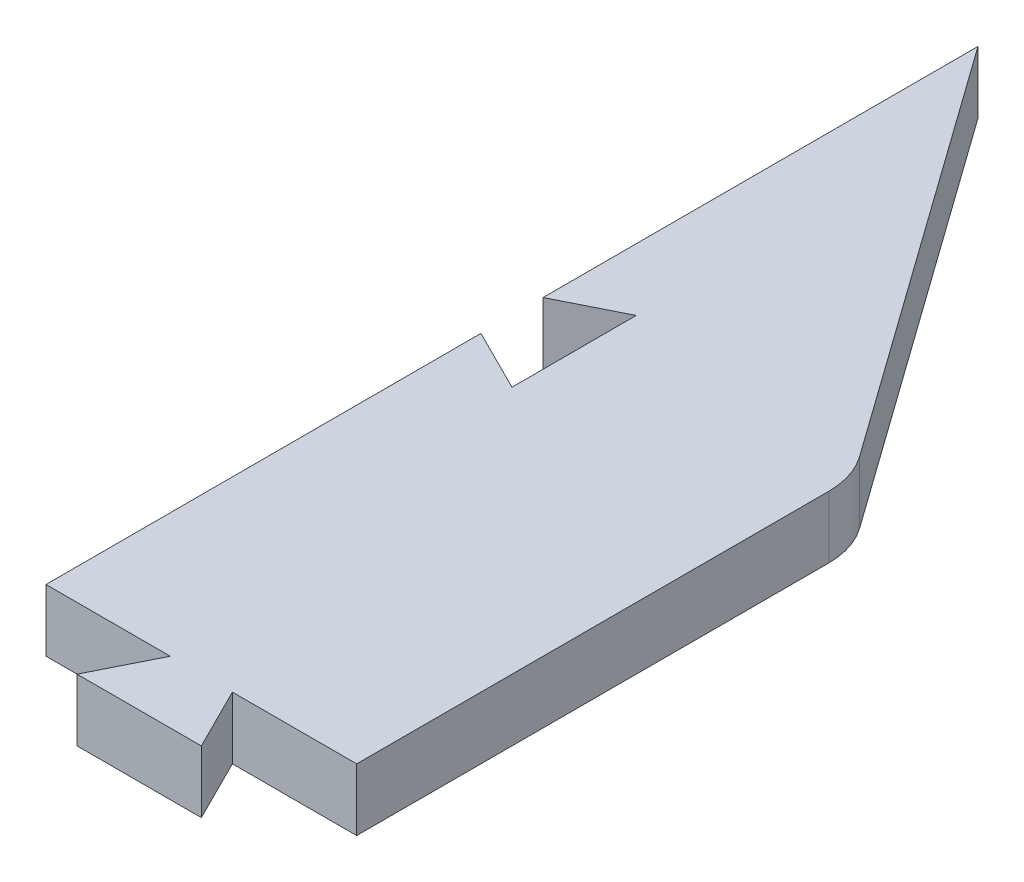
from build123d import *

# Parameters (mm, degrees)
EXTRUDE_1_DEPTH = 4


with BuildPart() as part:
    # Эскиз1 → Бобышка-Вытянуть1 (new body)
    with BuildSketch(Plane(origin=(0, 0, 0), x_dir=(1, 0, 0), z_dir=(0, 1, 0))):
        with BuildLine():
            Line((29.068667356, 15.803865702), (10, 42.5))
            Line((10, 42.5), (10, 14.5))
            Line((10, 14.5), (14, 16.5))
            Line((14, 16.5), (14, 8.5))
            Line((14, 8.5), (10, 10.5))
            Line((10, 10.5), (10, -17.5))
            Line((10, -17.5), (18, -17.5))
            Line((18, -17.5), (16, -21.5))
            Line((16, -21.5), (24, -21.5))
            Line((24, -21.5), (22, -17.5))
            Line((22, -17.5), (30, -17.5))
            Line((30, -17.5), (30, 12.897674733))
            ThreePointArc((30, 12.897674733), (29.761477543, 14.423561888), (29.068667356, 15.803865702))
        make_face()
    extrude(amount=EXTRUDE_1_DEPTH)


solid = part.part
